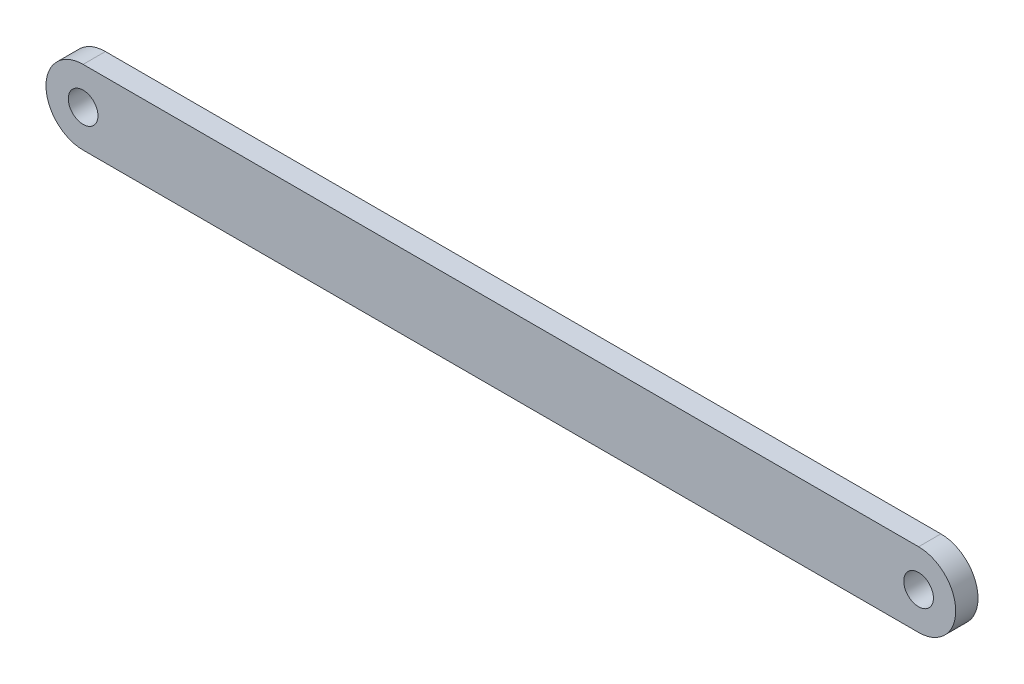
from build123d import *

# Parameters (mm, degrees)
SKETCH_1_R      = 2
EXTRUDE_1_DEPTH = 1.5


with BuildPart() as part:
    # 草图1 → 凸台-拉伸1 (new, symmetric)
    with BuildSketch(Plane.XY):
        with BuildLine():
            Line((0, 5), (112.5, 5))
            ThreePointArc((112.5, 5), (117.5, 0), (112.5, -5))
            Line((112.5, -5), (0, -5))
            ThreePointArc((0, -5), (-5, 0), (0, 5))
        make_face()
        Circle(SKETCH_1_R, mode=Mode.SUBTRACT)
        with Locations((112.5, 0)):
            Circle(SKETCH_1_R, mode=Mode.SUBTRACT)
    extrude(amount=EXTRUDE_1_DEPTH, both=True)


solid = part.part
